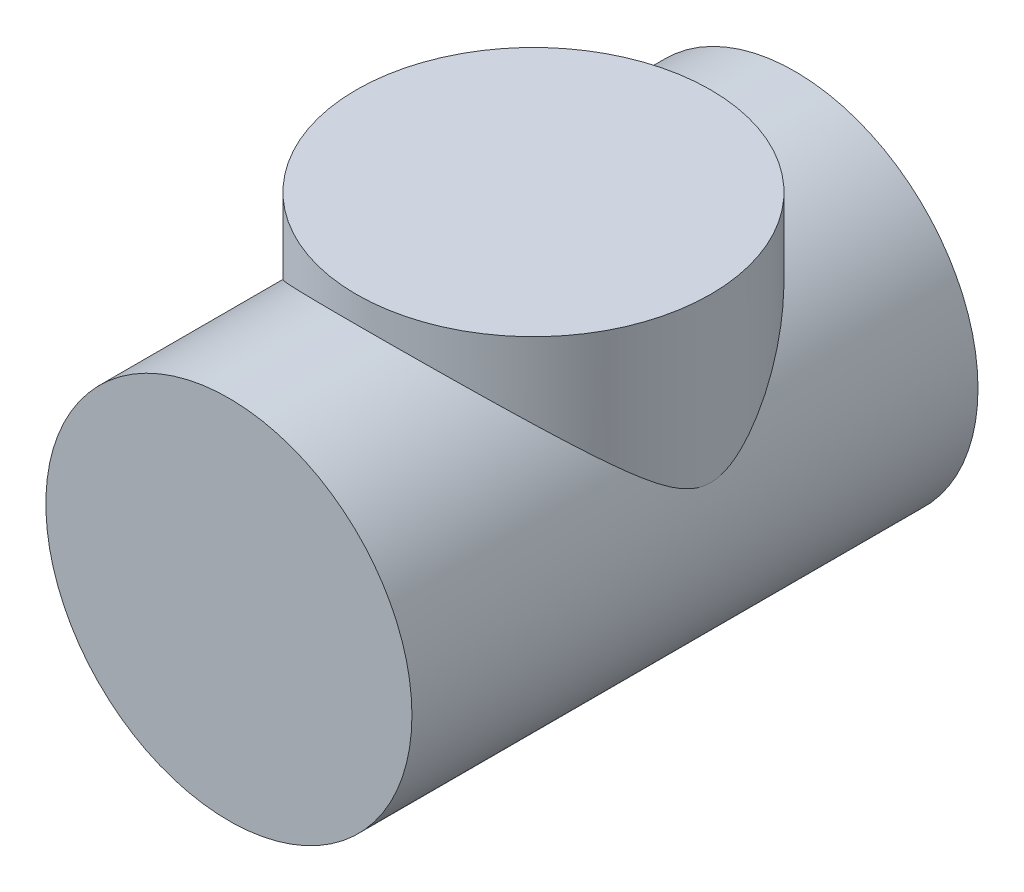
from build123d import *

# Parameters (mm, degrees)
BOSS_EXTRUDE1_START = -0.085
SKETCH1_R           = 0.0595
BOSS_EXTRUDE1_DEPTH = 0.184
SKETCH2_R           = 0.057585975
BOSS_EXTRUDE2_DEPTH = 0.068


with BuildPart() as part:
    # Sketch1 → Boss-Extrude1 (new body)
    with BuildSketch(Plane.XY.offset(BOSS_EXTRUDE1_START)):
        Circle(SKETCH1_R)
    extrude(amount=BOSS_EXTRUDE1_DEPTH)

    # Sketch2 → Boss-Extrude2 (add)
    with BuildSketch(Plane(origin=(0, 0, 0), x_dir=(1, 0, 0), z_dir=(0, 1, 0))):
        with Locations(Location((0, 0, 0), (0, 0, 90))):
            Circle(SKETCH2_R)
    extrude(amount=BOSS_EXTRUDE2_DEPTH)


solid = part.part
